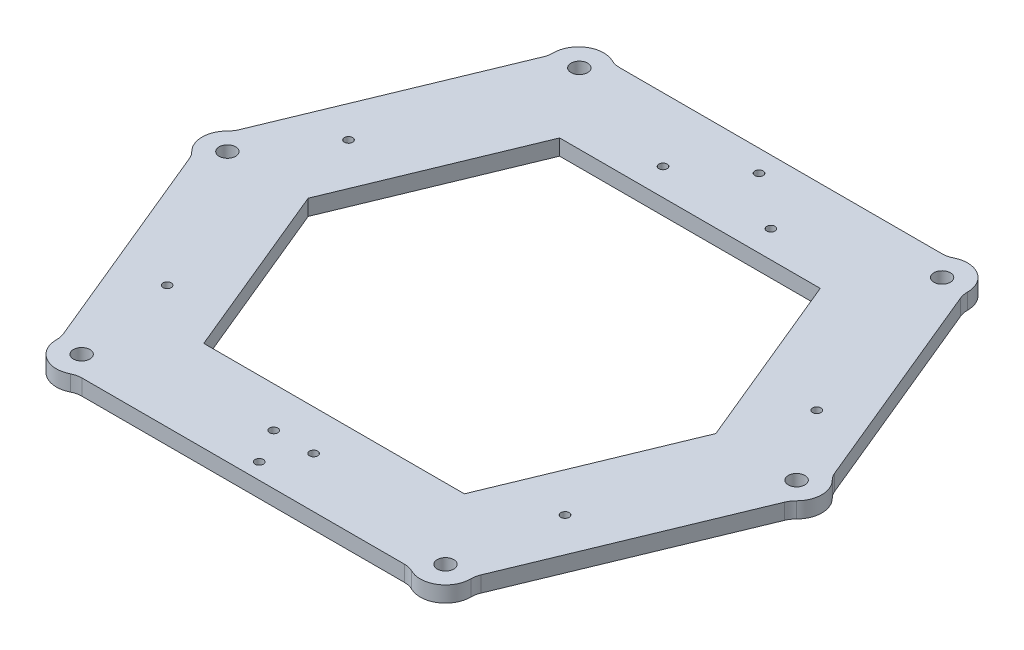
from build123d import *

# Parameters (mm, degrees)
BOSS_EXTRUDE2_DEPTH             = 4.7752
CUT_EXTRUDE1_DEPTH              = 124.57218077
CUT_EXTRUDE1_DEPTH_BACK         = 124.57218077
F_2_5MM_DOWEL_HOLE1_D           = 2.5
F_2_5MM_DOWEL_HOLE1_CSINK_D     = 2.55
F_2_5MM_DOWEL_HOLE1_CSINK_ANGLE = 90
SKETCH7_R                       = 7.62
BOSS_EXTRUDE3_DEPTH             = 4.7752
FILLET1_R                       = 6.35
F_5_0MM_DOWEL_HOLE1_D           = 5
F_5_0MM_DOWEL_HOLE1_CSINK_D     = 5.05
F_5_0MM_DOWEL_HOLE1_CSINK_ANGLE = 90


with BuildPart() as part:
    # Sketch1 → Boss-Extrude2 (new body)
    with BuildSketch(Plane(origin=(0, 0, 0), x_dir=(1, 0, 0), z_dir=(0, 1, 0))):
        Polygon((-59.461458223, 81.205013652), (-93.021648464, 0), (-59.461458223, -81.205013652), (59.461458223, -81.205013652), (93.021648464, 0), (59.461458223, 81.205013652), align=None)
    extrude(amount=BOSS_EXTRUDE2_DEPTH)

    # Sketch4 → Cut-Extrude1 (cut, two sides: drawn at the far end of the back side and taken through both)
    with BuildSketch(Plane.XZ.offset(-CUT_EXTRUDE1_DEPTH_BACK)):
        Polygon((-39.361989183, 53.755675768), (-61.577990685, 0), (-39.361989183, -53.755675768), (39.361989183, -53.755675768), (61.577990685, 0), (39.361989183, 53.755675768), align=None)
    extrude(amount=CUT_EXTRUDE1_DEPTH + CUT_EXTRUDE1_DEPTH_BACK, mode=Mode.SUBTRACT)

    # Ø2.5mm Dowel Hole1 (through all)
    with Locations(Plane(origin=(-6.03758, 0, 65.965013652), x_dir=(0, 0, -1), z_dir=(0, -1, 0))):
        with Locations((0, 0), (0, 12.07516), (127.889, -10.25652), (127.889, 22.33168), (140.589, 6.03758), (-10.414, 6.03758), (21.888921631, -54.068737531), (87.314572085, -64.692973675), (87.314572085, 76.768133675), (21.888921631, 66.143897531)):
            CounterSinkHole(F_2_5MM_DOWEL_HOLE1_D / 2, F_2_5MM_DOWEL_HOLE1_CSINK_D / 2, counter_sink_angle=F_2_5MM_DOWEL_HOLE1_CSINK_ANGLE)

    # Sketch7 → Boss-Extrude3 (add)
    with BuildSketch(Plane.XZ):
        with Locations((-54.959644352, 75.057)):
            Circle(SKETCH7_R)
        with Locations((54.959644352, 75.057)):
            Circle(SKETCH7_R)
        with Locations((85.979, 0)):
            Circle(SKETCH7_R)
        with Locations((54.959644352, -75.057)):
            Circle(SKETCH7_R)
        with Locations((-54.959644352, -75.057)):
            Circle(SKETCH7_R)
        with Locations((-85.979, 0)):
            Circle(SKETCH7_R)
    extrude(amount=-BOSS_EXTRUDE3_DEPTH)

    # Fillet1
    fillet1_edges = [part.edges().sort_by_distance(p)[0] for p in [
        (-62.488338925, 2.3876, 73.880922611),
        (-50.45783048, 2.3876, 81.205013652),
        (50.45783048, 2.3876, 81.205013652),
        (62.488338925, 2.3876, 73.880922611),
        (90.480813872, 2.3876, 6.148013652),
        (90.480813872, 2.3876, -6.148013652),
        (50.45783048, 2.3876, -81.205013652),
        (62.488338925, 2.3876, -73.880922611),
        (-50.45783048, 2.3876, -81.205013652),
        (-62.488338925, 2.3876, -73.880922611),
        (-90.480813872, 2.3876, -6.148013652),
        (-90.480813872, 2.3876, 6.148013652),
    ]]
    fillet(fillet1_edges, radius=FILLET1_R)

    # Ø5.0mm Dowel Hole1 (through all)
    with Locations(Plane(origin=(-54.959644352, 0, 75.057), x_dir=(0, 0, -1), z_dir=(0, -1, 0))):
        with Locations((0, 0), (150.062149462, 109.88132173), (150.114, 0.244119934), (75.057, -31.019355648), (75.057, 140.938644352), (0, 109.919288704)):
            CounterSinkHole(F_5_0MM_DOWEL_HOLE1_D / 2, F_5_0MM_DOWEL_HOLE1_CSINK_D / 2, counter_sink_angle=F_5_0MM_DOWEL_HOLE1_CSINK_ANGLE)


solid = part.part
